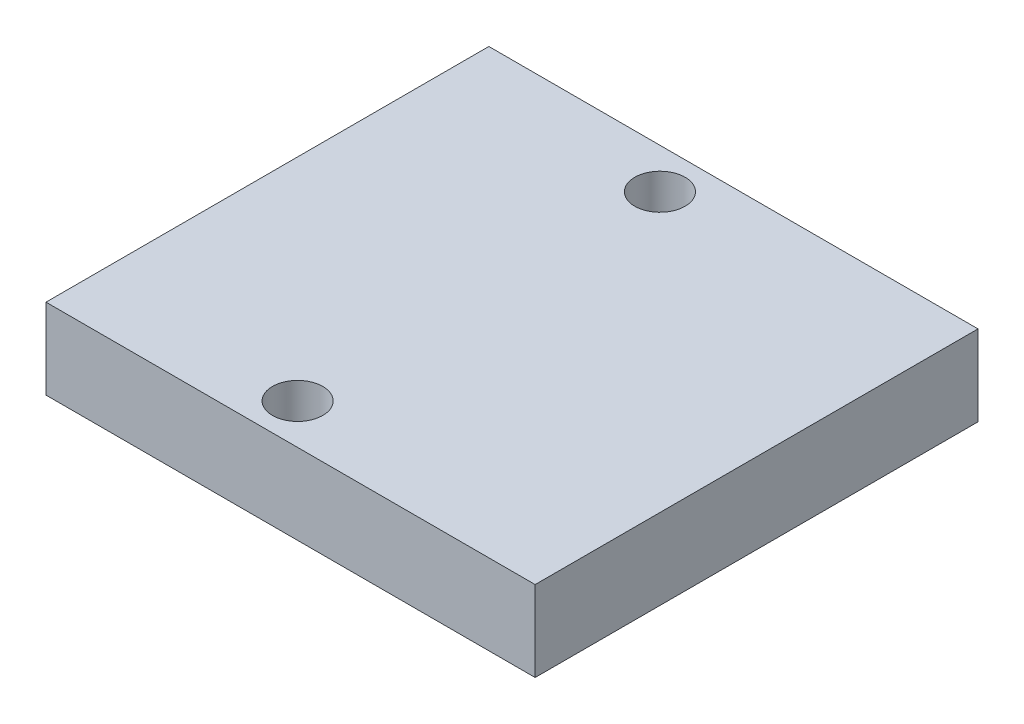
from build123d import *

# Parameters (mm, degrees)
SKETCH1_W           = 24.3
SKETCH1_H           = 22
SKETCH1_R           = 1.25
BOSS_EXTRUDE1_DEPTH = 4


with BuildPart() as part:
    # Sketch1 → Boss-Extrude1 (new body)
    with BuildSketch(Plane(origin=(0, 0, 0), x_dir=(1, 0, 0), z_dir=(0, 1, 0))):
        Rectangle(SKETCH1_W, SKETCH1_H)
        with Locations(Location((-1.65, 9, 0), (0, 0, 270))):
            Circle(SKETCH1_R, mode=Mode.SUBTRACT)
        with Locations(Location((-1.65, -9, 0), (0, 0, 90))):
            Circle(SKETCH1_R, mode=Mode.SUBTRACT)
    extrude(amount=BOSS_EXTRUDE1_DEPTH)


solid = part.part
